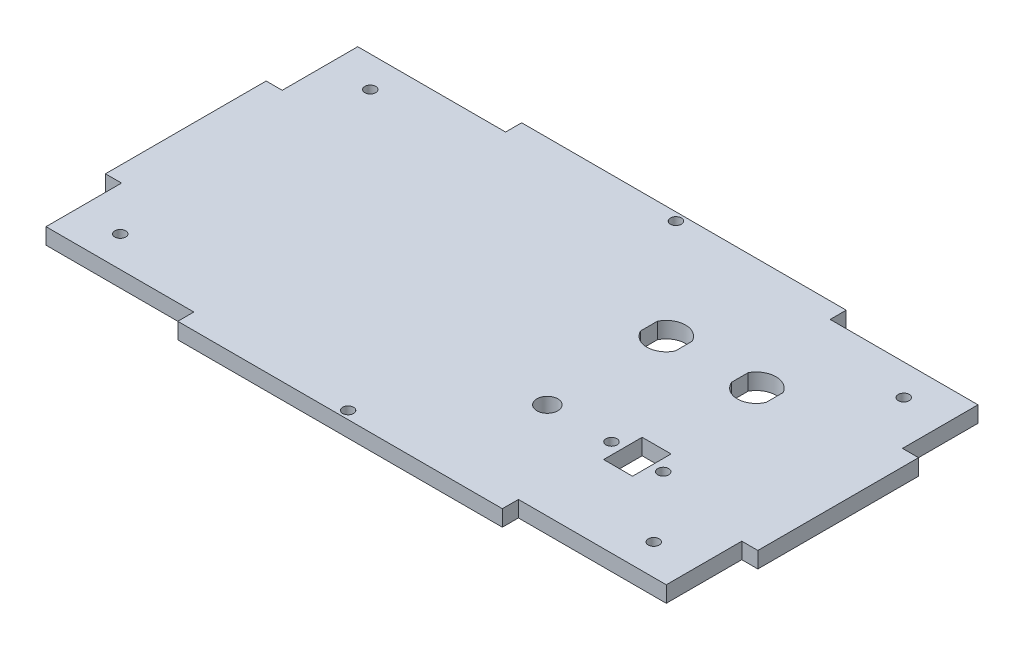
from build123d import *

# Parameters (mm, degrees)
SKETCH1_W            = 203
SKETCH1_H            = 107
BOSS_EXTRUDE1_DEPTH  = 5
SKETCH3_W            = 51
SKETCH3_H            = 5
CUT_EXTRUDE1_DEPTH   = 230.527776097
SKETCH4_W            = 5
SKETCH4_H            = 28.5
CUT_EXTRUDE2_DEPTH   = 230.527776097
CUT_EXTRUDE3_DEPTH   = 230.527776097
SKETCH10_R           = 3.25
CUT_EXTRUDE4_DEPTH   = 230.527776097
M3_CLEARANCE_HOLE1_D = 3.4
SKETCH13_W           = 9
SKETCH13_H           = 12
CUT_EXTRUDE5_DEPTH   = 230.527776097
M3_CLEARANCE_HOLE2_D = 3.4
M3_CLEARANCE_HOLE3_D = 3.4


with BuildPart() as part:
    # Sketch1 → Boss-Extrude1 (new body)
    with BuildSketch(Plane(origin=(0, 0, 0), x_dir=(1, 0, 0), z_dir=(0, 1, 0))):
        with Locations((101.5, 53.5)):
            Rectangle(SKETCH1_W, SKETCH1_H)
    extrude(amount=BOSS_EXTRUDE1_DEPTH)

    # Sketch3 → Cut-Extrude1 (cut, through all)
    with BuildSketch(Plane(origin=(0, 5, 0), x_dir=(1, 0, 0), z_dir=(0, 1, 0))):
        with Locations((25.5, 104.5)):
            Rectangle(SKETCH3_W, SKETCH3_H)
        with Locations((177.5, 104.5)):
            Rectangle(SKETCH3_W, SKETCH3_H)
        with Locations((25.5, 2.5)):
            Rectangle(SKETCH3_W, SKETCH3_H)
        with Locations((177.5, 2.5)):
            Rectangle(SKETCH3_W, SKETCH3_H)
    extrude(amount=-CUT_EXTRUDE1_DEPTH, mode=Mode.SUBTRACT)

    # Sketch4 → Cut-Extrude2 (cut, through all)
    with BuildSketch(Plane(origin=(0, 5, 0), x_dir=(1, 0, 0), z_dir=(0, 1, 0))):
        with Locations((2.5, 92.75)):
            Rectangle(SKETCH4_W, SKETCH4_H)
        with Locations((2.5, 14.25)):
            Rectangle(SKETCH4_W, SKETCH4_H)
        with Locations((200.5, 14.25)):
            Rectangle(SKETCH4_W, SKETCH4_H)
        with Locations((200.5, 92.75)):
            Rectangle(SKETCH4_W, SKETCH4_H)
    extrude(amount=-CUT_EXTRUDE2_DEPTH, mode=Mode.SUBTRACT)

    # Sketch7 → Cut-Extrude3 (cut, through all)
    with BuildSketch(Plane.XZ):
        with BuildLine():
            Line((164.385100742, -69.683506307), (164.385100742, -74.945459))
            ThreePointArc((164.385100742, -74.945459), (158.96865866, -78.137919554), (153.585100742, -74.890312225))
            Line((153.585100742, -74.890312225), (153.585100742, -69.754043843))
            ThreePointArc((153.585100742, -69.754043843), (158.961713268, -66.137919554), (164.385100742, -69.683506307))
        make_face()
        with BuildLine():
            Line((136.4, -69.402295461), (136.4, -74.632878398))
            ThreePointArc((136.4, -74.632878398), (131, -78.007665824), (125.6, -74.632878398))
            Line((125.6, -74.632878398), (125.6, -69.402295461))
            ThreePointArc((125.6, -69.402295461), (131, -66.007665824), (136.4, -69.402295461))
        make_face()
    extrude(amount=-CUT_EXTRUDE3_DEPTH, mode=Mode.SUBTRACT)

    # Sketch10 → Cut-Extrude4 (cut, through all)
    with BuildSketch(Plane.XZ):
        with Locations(Location((131, -35, 0), (0, 0, 270))):
            Circle(SKETCH10_R)
    extrude(amount=-CUT_EXTRUDE4_DEPTH, mode=Mode.SUBTRACT)

    # M3 Clearance Hole1 (through all)
    with Locations(Plane(origin=(0, 0, 0), x_dir=(-1, 0, 0), z_dir=(0, -1, 0))):
        with Locations((-18.5, 14.6), (-184.5, 14.6), (-184.5, 92.4), (-18.5, 92.4)):
            Hole(M3_CLEARANCE_HOLE1_D / 2)

    # Sketch13 → Cut-Extrude5 (cut, through all)
    with BuildSketch(Plane(origin=(0, 0, 0), x_dir=(-1, 0, 0), z_dir=(0, -1, 0))):
        with Locations((-159, 35)):
            Rectangle(SKETCH13_W, SKETCH13_H)
    extrude(amount=-CUT_EXTRUDE5_DEPTH, mode=Mode.SUBTRACT)

    # M3 Clearance Hole2 (through all)
    with Locations(Plane(origin=(0, 0, 0), x_dir=(-1, 0, 0), z_dir=(0, -1, 0))):
        with Locations((-150.95, 35), (-167.05, 35)):
            Hole(M3_CLEARANCE_HOLE2_D / 2)

    # M3 Clearance Hole3 (through all)
    with Locations(Plane(origin=(0, 0, 0), x_dir=(-1, 0, 0), z_dir=(0, -1, 0))):
        with Locations((-101.5, 104.5), (-101.5, 2.5)):
            Hole(M3_CLEARANCE_HOLE3_D / 2)


solid = part.part
